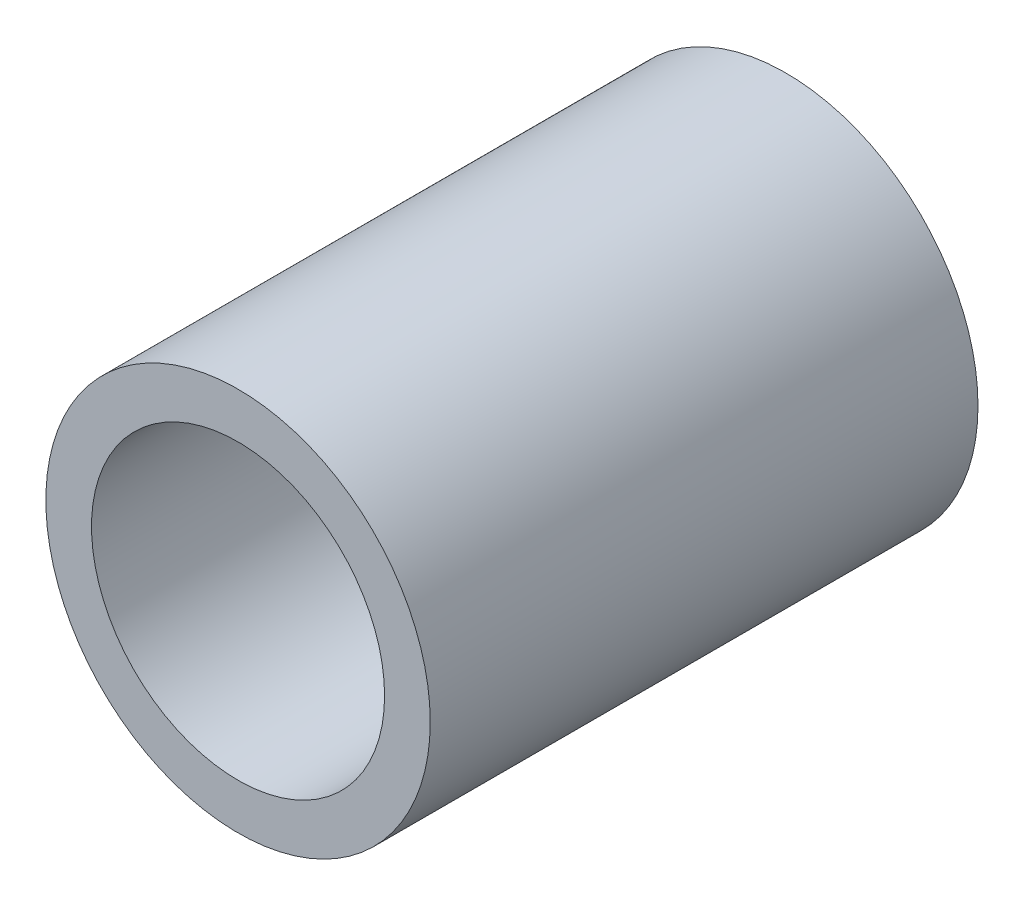
from build123d import *

# Parameters (mm, degrees)
S01_INSTALLED_BRASS_ENVELOPE_SIMPLIF_R       = 2
S01_INSTALLED_BRASS_ENVELOPE_SIMPLIF_R_2     = 1.525
F_01_INSTALLED_BRASS_ENVELOPE_SIMPLIFI_DEPTH = 5.7


with BuildPart() as part:
    # S01 - Installed brass envelope - simplified threads → 01 - Installed brass envelope - simplified threads (new body)
    with BuildSketch(Plane.XY):
        Circle(S01_INSTALLED_BRASS_ENVELOPE_SIMPLIF_R)
        Circle(S01_INSTALLED_BRASS_ENVELOPE_SIMPLIF_R_2, mode=Mode.SUBTRACT)
    extrude(amount=F_01_INSTALLED_BRASS_ENVELOPE_SIMPLIFI_DEPTH)


solid = part.part
